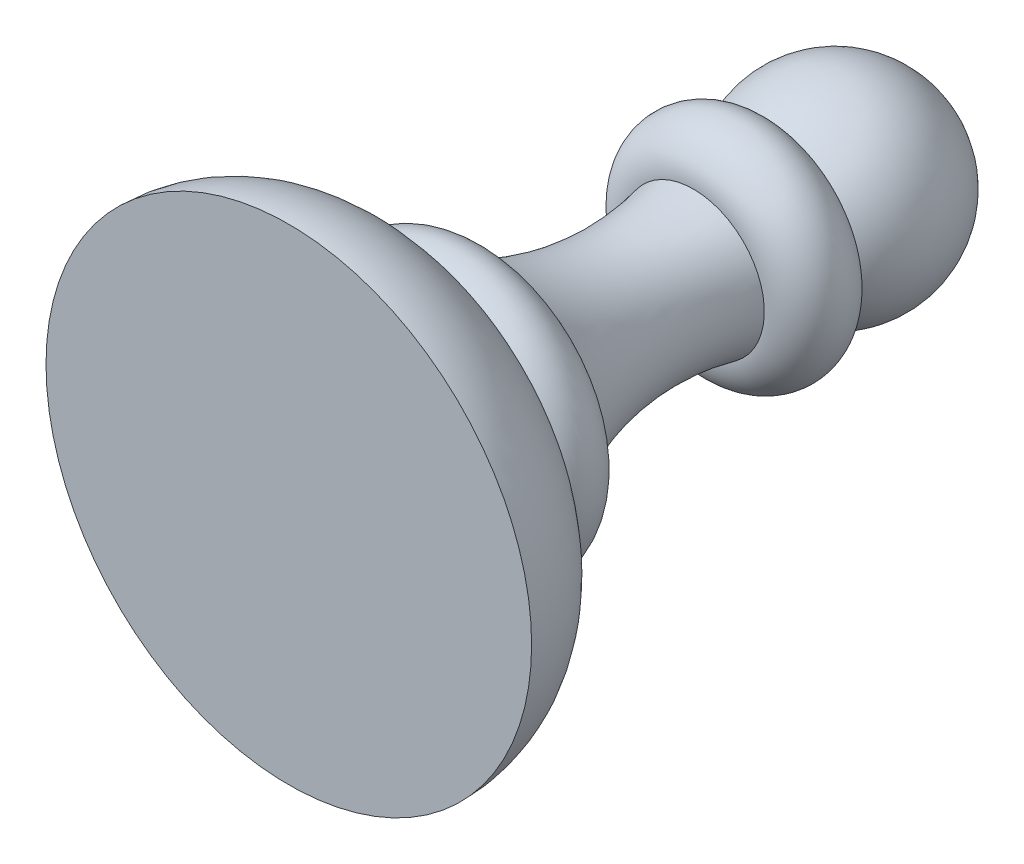
from build123d import *


with BuildPart() as part:
    # Sketch1 → Revolve1 (revolve)
    with BuildSketch(Plane(origin=(0, 0, 0), x_dir=(1, 0, 0), z_dir=(0, 1, 0)), mode=Mode.PRIVATE) as revolve1_sk:
        with BuildLine():
            Line((25, -105), (0, -105))
            Line((0, -105), (0, -135))
            Line((0, -135), (60, -135))
            ThreePointArc((60, -135), (51.213203436, -113.786796564), (30, -105))
            Line((30, -105), (25, -105))
        make_face()
        with BuildLine():
            Line((25, -85), (0, -85))
            Line((0, -85), (0, -105))
            Line((0, -105), (25, -105))
            ThreePointArc((25, -105), (35, -95), (25, -85))
        make_face()
        with BuildLine():
            Line((17.5, -35), (0, -35))
            Line((0, -35), (0, -85))
            Line((0, -85), (25, -85))
            ThreePointArc((25, -85), (16.578123197, -60.70078152), (17.5, -35))
        make_face()
        with BuildLine():
            ThreePointArc((19.796695306, -15.267313286), (11.02989501, -22.435271696), (0, -25))
            Line((0, -25), (0, -35))
            Line((0, -35), (17.5, -35))
            ThreePointArc((17.5, -35), (27.432946872, -26.156099663), (19.796695306, -15.267313286))
        make_face()
        with BuildLine():
            ThreePointArc((25, 0), (17.67766953, 17.67766953), (0, 25))
            Line((0, 25), (0, -15))
            Line((0, -15), (17.5, -15))
            ThreePointArc((17.5, -15), (18.656099663, -15.067053128), (19.796695306, -15.267313286))
            ThreePointArc((19.796695306, -15.267313286), (23.663446311, -8.064819197), (25, 0))
        make_face()
        with BuildLine():
            Line((17.5, -15), (0, -15))
            Line((0, -15), (0, -25))
            ThreePointArc((0, -25), (11.02989501, -22.435271696), (19.796695306, -15.267313286))
            ThreePointArc((19.796695306, -15.267313286), (18.656099663, -15.067053128), (17.5, -15))
        make_face()
    revolve(revolve1_sk.sketch.rotate(Axis((0, 0, -25), (0, 0, 1)), 180), axis=Axis((0, 0, -25), (0, 0, 1)))


solid = part.part
